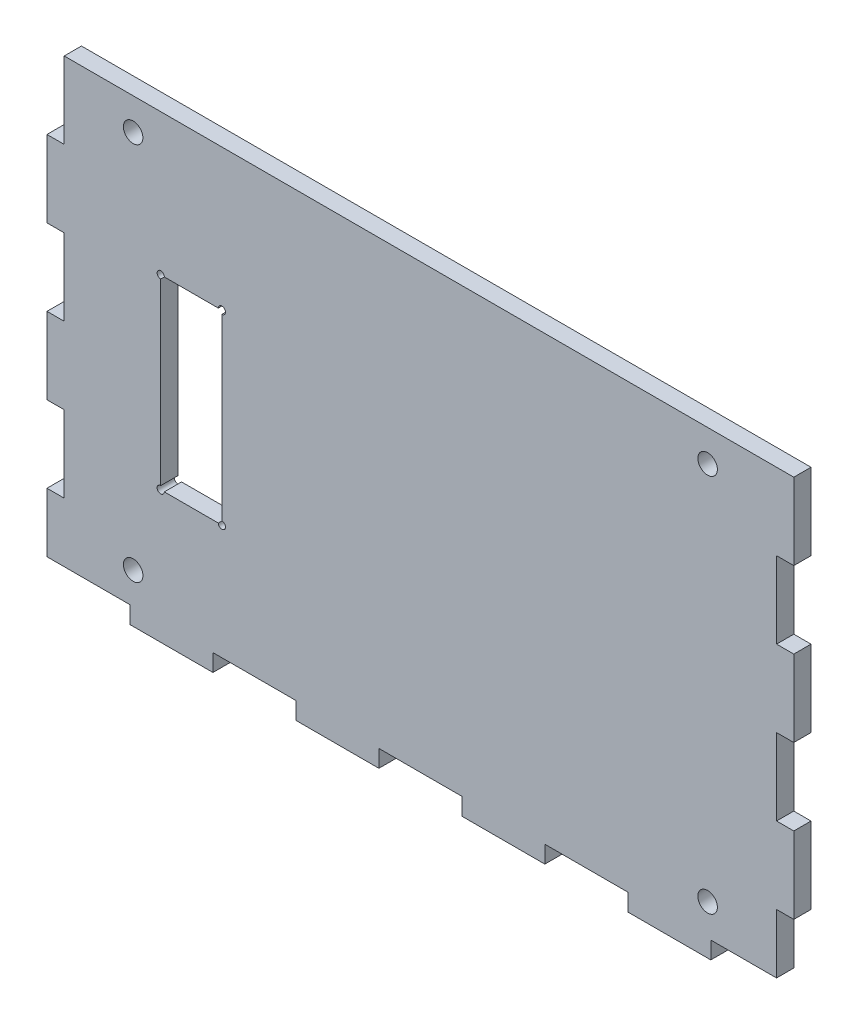
from build123d import *

# Parameters (mm, degrees)
SKETCH1_W                   = 130
SKETCH1_H                   = 80
BOSS_EXTRUDE1_DEPTH         = 3
SKETCH2_W                   = 14.444444444
SKETCH2_H                   = 3
SKETCH2_W_2                 = 3
SKETCH2_H_2                 = 13.333333334
SKETCH2_H_3                 = 13.333333333
CUT_EXTRUDE1_DEPTH          = 153.672852859
CUT_CORNERPIECE_HOLES_REACH = 154.673
SKETCH3_R                   = 1.7
CUT_EXTRUDE3_REACH          = 154.673


with BuildPart() as part:
    # Sketch1 → Boss-Extrude1 (new body)
    with BuildSketch(Plane.XY):
        with Locations((65, 40)):
            Rectangle(SKETCH1_W, SKETCH1_H)
    extrude(amount=BOSS_EXTRUDE1_DEPTH)

    # Sketch2 → Cut-Extrude1 (cut, through all)
    with BuildSketch(Plane.XY.offset(3)):
        with Locations((7.222222222, 1.5)):
            Rectangle(SKETCH2_W, SKETCH2_H)
        with Locations((36.111111111, 1.5)):
            Rectangle(SKETCH2_W, SKETCH2_H)
        with Locations((65, 1.5)):
            Rectangle(SKETCH2_W, SKETCH2_H)
        with Locations((93.888888889, 1.5)):
            Rectangle(SKETCH2_W, SKETCH2_H)
        Polygon((115.555555556, 0), (115.555555556, 3), (127, 3), (127, 13.333333333), (130, 13.333333333), (130, 0), align=None)
        with Locations((1.5, 20)):
            Rectangle(SKETCH2_W_2, SKETCH2_H_2)
        with Locations((1.5, 46.666666667)):
            Rectangle(SKETCH2_W_2, SKETCH2_H_3)
        with Locations((1.5, 73.333333334)):
            Rectangle(SKETCH2_W_2, SKETCH2_H_3)
        with Locations((128.5, 33.333333334)):
            Rectangle(SKETCH2_W_2, SKETCH2_H_3)
        with Locations((128.5, 60)):
            Rectangle(SKETCH2_W_2, SKETCH2_H_2)
    extrude(amount=-CUT_EXTRUDE1_DEPTH, mode=Mode.SUBTRACT)

    # Sketch3 → Cut cornerpiece holes (cut, up to next)
    with BuildSketch(Plane.XY.offset(3), mode=Mode.PRIVATE) as cut_cornerpiece_holes_sk1:
        with Locations((15, 74.5)):
            Circle(SKETCH3_R)
    cut_cornerpiece_holes_tool1 = extrude(cut_cornerpiece_holes_sk1.sketch, amount=-CUT_CORNERPIECE_HOLES_REACH, mode=Mode.PRIVATE) & part.part
    # Sketch3 → Cut cornerpiece holes (cut, up to next)
    with BuildSketch(Plane.XY.offset(3), mode=Mode.PRIVATE) as cut_cornerpiece_holes_sk2:
        with Locations((115, 74.5)):
            Circle(SKETCH3_R)
    cut_cornerpiece_holes_tool2 = extrude(cut_cornerpiece_holes_sk2.sketch, amount=-CUT_CORNERPIECE_HOLES_REACH, mode=Mode.PRIVATE) & part.part
    # Sketch3 → Cut cornerpiece holes (cut, up to next)
    with BuildSketch(Plane.XY.offset(3), mode=Mode.PRIVATE) as cut_cornerpiece_holes_sk3:
        with Locations((15, 8.5)):
            Circle(SKETCH3_R)
    cut_cornerpiece_holes_tool3 = extrude(cut_cornerpiece_holes_sk3.sketch, amount=-CUT_CORNERPIECE_HOLES_REACH, mode=Mode.PRIVATE) & part.part
    # Sketch3 → Cut cornerpiece holes (cut, up to next)
    with BuildSketch(Plane.XY.offset(3), mode=Mode.PRIVATE) as cut_cornerpiece_holes_sk4:
        with Locations((115, 8.5)):
            Circle(SKETCH3_R)
    cut_cornerpiece_holes_tool4 = extrude(cut_cornerpiece_holes_sk4.sketch, amount=-CUT_CORNERPIECE_HOLES_REACH, mode=Mode.PRIVATE) & part.part
    add(cut_cornerpiece_holes_tool1.solids().sort_by_distance((15, 74.5, 3))[0], mode=Mode.SUBTRACT)
    add(cut_cornerpiece_holes_tool2.solids().sort_by_distance((115, 74.5, 3))[0], mode=Mode.SUBTRACT)
    add(cut_cornerpiece_holes_tool3.solids().sort_by_distance((15, 8.5, 3))[0], mode=Mode.SUBTRACT)
    add(cut_cornerpiece_holes_tool4.solids().sort_by_distance((115, 8.5, 3))[0], mode=Mode.SUBTRACT)

    # Sketch4 → Cut-Extrude3 (cut, up to next)
    with BuildSketch(Plane(origin=(0, 0, 0), x_dir=(-1, 0, 0), z_dir=(0, 0, -1)), mode=Mode.PRIVATE) as cut_extrude3_sk1:
        with BuildLine():
            Line((-29.825, 55.4), (-20.425, 55.4))
            ThreePointArc((-20.425, 55.4), (-19.358058262, 55.841941738), (-19.8, 54.775))
            Line((-19.8, 54.775), (-19.8, 23.625))
            ThreePointArc((-19.8, 23.625), (-19.358058262, 22.558058262), (-20.425, 23))
            Line((-20.425, 23), (-29.825, 23))
            ThreePointArc((-29.825, 23), (-30.891941738, 22.558058262), (-30.45, 23.625))
            Line((-30.45, 23.625), (-30.45, 54.775))
            ThreePointArc((-30.45, 54.775), (-30.891941738, 55.841941738), (-29.825, 55.4))
        make_face()
    cut_extrude3_tool1 = extrude(cut_extrude3_sk1.sketch, amount=-CUT_EXTRUDE3_REACH, mode=Mode.PRIVATE) & part.part
    add(cut_extrude3_tool1.solids().sort_by_distance((25.125, 39.2, 0))[0], mode=Mode.SUBTRACT)


solid = part.part
